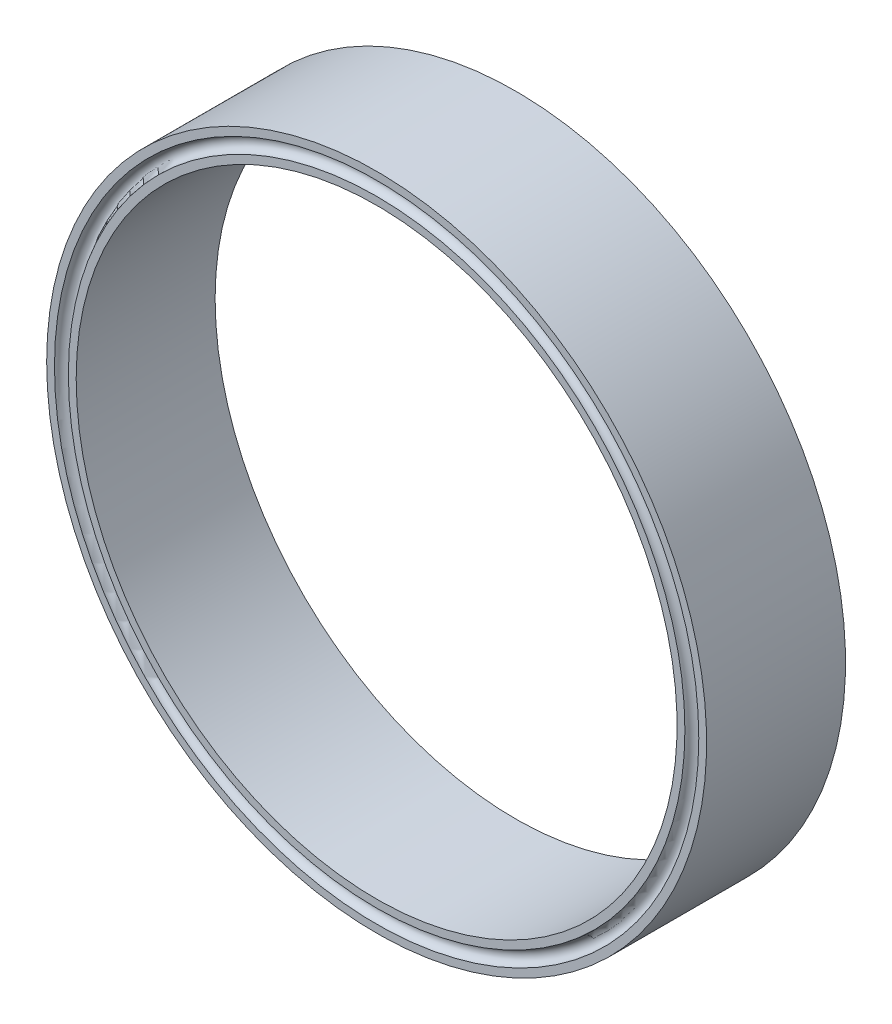
from build123d import *


with BuildPart() as part:
    # Sketch1 → Revolve1 (revolve)
    with BuildSketch(Plane(origin=(0, 0, 0), x_dir=(1, 0, 0), z_dir=(0, 1, 0)), mode=Mode.PRIVATE) as revolve1_sk:
        with BuildLine():
            Line((23.75, -10), (23.75, 10))
            Line((23.75, 10), (22.625, 10))
            ThreePointArc((22.625, 10), (21.625, 9), (20.625, 10))
            Line((20.625, 10), (19.5, 10))
            Line((19.5, 10), (19.5, -10))
            Line((19.5, -10), (20.625, -10))
            ThreePointArc((20.625, -10), (21.625, -9), (22.625, -10))
            Line((22.625, -10), (23.75, -10))
        make_face()
    revolve(revolve1_sk.sketch.rotate(Axis((-23.75, 0, -10), (0, 0, 1)), 180), axis=Axis((-23.75, 0, -10), (0, 0, 1)))


solid = part.part
